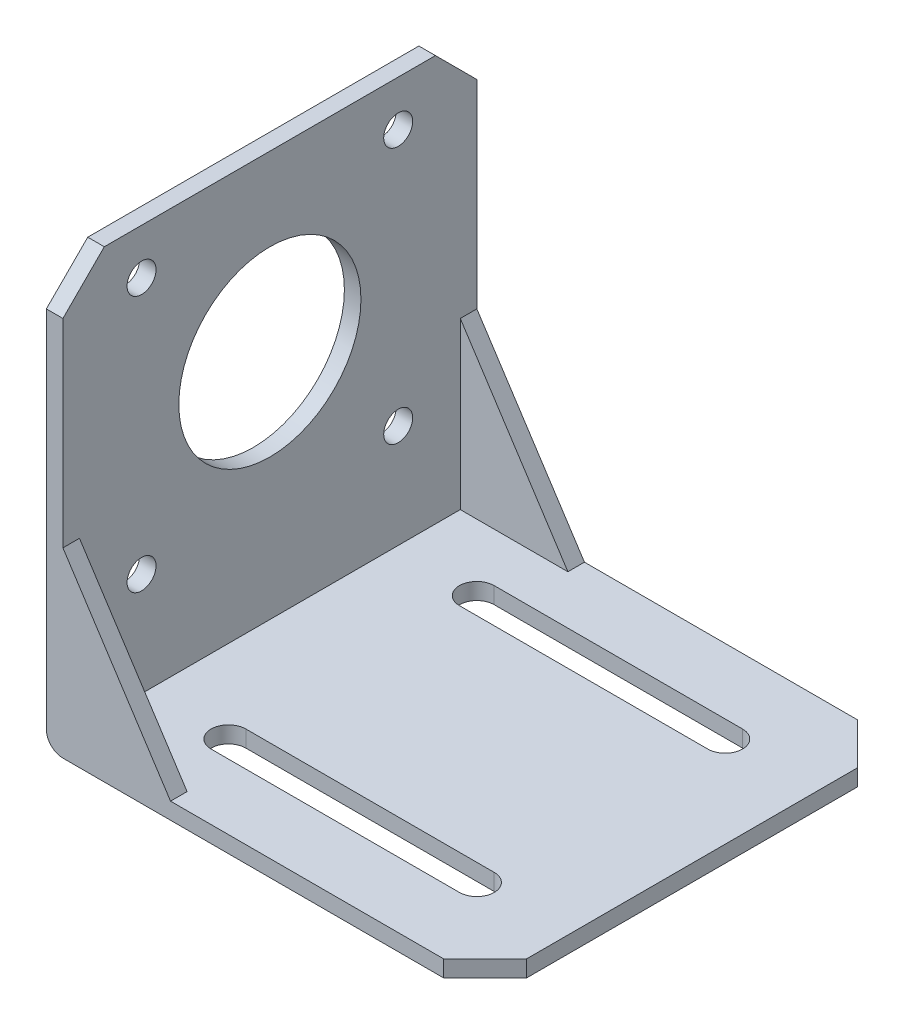
from build123d import *

# Parameters (mm, degrees)
EXTRUDE_1_DEPTH = 2
SKETCH_2_R      = 1.75
EXTRUDE_2_DEPTH = 2
FILLET_1_R      = 2
EXTRUDE_3_DEPTH = 2


with BuildPart() as part:
    # 草图1 → 凸台-拉伸1 (new body)
    with BuildSketch(Plane(origin=(0, 0, 0), x_dir=(1, 0, 0), z_dir=(0, 1, 0))):
        Polygon((0, 0), (0, 25), (48, 25), (53, 20), (53, 0), align=None)
        with BuildLine():
            Line((12, 17.1), (42, 17.1))
            ThreePointArc((42, 17.1), (44.1, 15), (42, 12.9))
            Line((42, 12.9), (12, 12.9))
            ThreePointArc((12, 12.9), (9.9, 15), (12, 17.1))
        make_face(mode=Mode.SUBTRACT)
    extrude_1 = extrude(amount=EXTRUDE_1_DEPTH)

    # 草图2 → 凸台-拉伸2 (add)
    with BuildSketch(Plane.ZY):
        with BuildLine():
            Line((-25, 46), (-25, 2))
            Line((-25, 2), (0, 2))
            Line((0, 2), (0, 19))
            ThreePointArc((0, 19), (-11, 30), (0, 41))
            Line((0, 41), (0, 51))
            Line((0, 51), (-20, 51))
            Line((-20, 51), (-25, 46))
        make_face()
        with Locations((-15.5, 14.5)):
            Circle(SKETCH_2_R, mode=Mode.SUBTRACT)
        with Locations((-15.5, 45.5)):
            Circle(SKETCH_2_R, mode=Mode.SUBTRACT)
    extrude_2 = extrude(amount=-EXTRUDE_2_DEPTH)

    # 镜向2: 凸台-拉伸1, 凸台-拉伸2 across plane
    add(extrude_1.mirror(Plane.XY))
    add(extrude_2.mirror(Plane.XY))

    # 圆角1
    fillet_1_edges = [part.edges().sort_by_distance(p)[0] for p in [
        (0, 0, 0),
    ]]
    fillet(fillet_1_edges, radius=FILLET_1_R)

    # 草图4 → 凸台-拉伸3 (add)
    with BuildSketch(Plane.XY.offset(25)):
        Polygon((2, 2), (2, 22), (15, 2), align=None)
    extrude_3 = extrude(amount=-EXTRUDE_3_DEPTH)

    # 镜向4: 凸台-拉伸3 across plane
    add(extrude_3.mirror(Plane.XY))


solid = part.part
